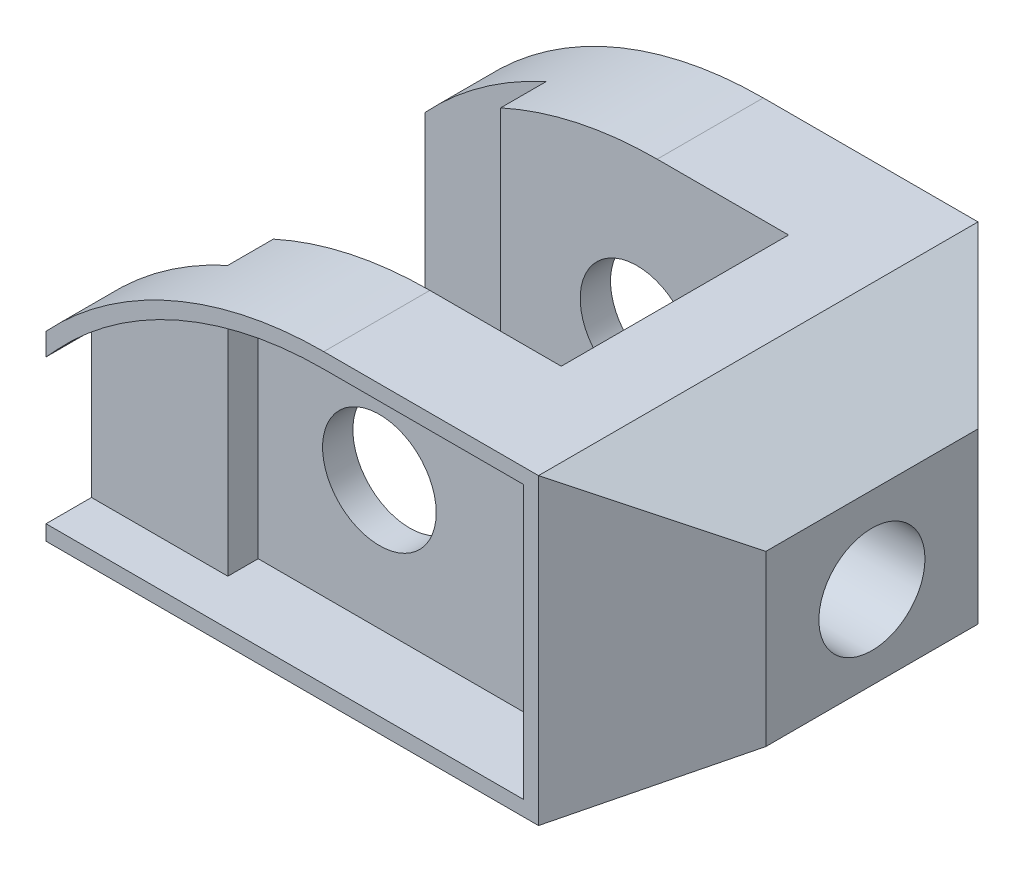
from build123d import *

# Parameters (mm, degrees)
BOSS_EXTRUDE1_DEPTH = 58
SKETCH3_R           = 7.5
CUT_EXTRUDE1_DEPTH  = 107.60206377
CUT_EXTRUDE2_DEPTH  = 107.60206377
CUT_EXTRUDE3_DEPTH  = 107.60206377
SKETCH6_R           = 7
CUT_EXTRUDE4_DEPTH  = 107.60206377
CUT_EXTRUDE5_DEPTH  = 6
CUT_EXTRUDE6_DEPTH  = 4
CUT_EXTRUDE7_START  = -6
CUT_EXTRUDE7_DEPTH  = 6
CUT_EXTRUDE8_START  = -4
CUT_EXTRUDE8_DEPTH  = 4


with BuildPart() as part:
    # Sketch2 → Boss-Extrude1 (new body)
    with BuildSketch(Plane.XY):
        with BuildLine():
            Line((0, 0), (65, 0))
            Line((65, 0), (80, 9.029262631))
            Line((80, 9.029262631), (80, 31.339745962))
            Line((80, 31.339745962), (65, 40))
            Line((65, 40), (36.66060556, 40))
            ThreePointArc((36.66060556, 40), (16.66060556, 35.82575695), (0, 24))
            Line((0, 24), (0, 0))
        make_face()
    extrude(amount=-BOSS_EXTRUDE1_DEPTH)

    # Sketch3 → Cut-Extrude1 (cut, through all)
    with BuildSketch(Plane.XY):
        with Locations((34, 19)):
            Circle(SKETCH3_R)
    extrude(amount=-CUT_EXTRUDE1_DEPTH, mode=Mode.SUBTRACT)

    # Sketch4 → Cut-Extrude2 (cut, through all)
    with BuildSketch(Plane(origin=(0, 0, 0), x_dir=(1, 0, 0), z_dir=(0, 1, 0))):
        Polygon((65, 58), (80, 43), (80, 58), align=None)
        Polygon((80, 0), (80, 15), (65, 0), align=None)
    extrude(amount=CUT_EXTRUDE2_DEPTH, mode=Mode.SUBTRACT)

    # Sketch5 → Cut-Extrude3 (cut, through all)
    with BuildSketch(Plane.XZ):
        Polygon((0, -8), (0, -50), (16, -50), (16, -44), (54, -44), (54, -14), (16, -14), (16, -8), align=None)
    extrude(amount=-CUT_EXTRUDE3_DEPTH, mode=Mode.SUBTRACT)

    # Sketch6 → Cut-Extrude4 (cut, through all)
    with BuildSketch(Plane(origin=(80, 0, 0), x_dir=(0, 0, -1), z_dir=(1, 0, 0))):
        with Locations((29, 20)):
            Circle(SKETCH6_R)
    extrude(amount=-CUT_EXTRUDE4_DEPTH, mode=Mode.SUBTRACT)

    # Sketch8 → Cut-Extrude5 (cut)
    with BuildSketch(Plane.XY):
        with BuildLine():
            Line((1.466424222, 22.64), (0, 21.058823529))
            Line((0, 21.058823529), (0, 2))
            Line((0, 2), (63, 2))
            Line((63, 2), (63, 38))
            Line((63, 38), (36.66060556, 38))
            ThreePointArc((36.66060556, 38), (17.46060556, 33.992726672), (1.466424222, 22.64))
        make_face()
    extrude(amount=-CUT_EXTRUDE5_DEPTH, mode=Mode.SUBTRACT)

    # Sketch9 → Cut-Extrude6 (cut)
    with BuildSketch(Plane.XY.offset(-6)):
        with BuildLine():
            Line((18, 2), (63, 2))
            Line((63, 2), (63, 38))
            Line((63, 38), (36.66060556, 38))
            ThreePointArc((36.66060556, 38), (27.141221384, 37.046586751), (18, 34.224221872))
            Line((18, 34.224221872), (18, 2))
        make_face()
    extrude(amount=-CUT_EXTRUDE6_DEPTH, mode=Mode.SUBTRACT)

    # Sketch10 → Cut-Extrude7 (cut)
    with BuildSketch(Plane(origin=(0, 0, -58), x_dir=(-1, 0, 0), z_dir=(0, 0, -1)).offset(CUT_EXTRUDE7_START)):
        with BuildLine():
            Line((-1.466424222, 22.64), (0, 21.058823529))
            Line((0, 21.058823529), (0, 2))
            Line((0, 2), (-63, 2))
            Line((-63, 2), (-63, 38))
            Line((-63, 38), (-36.66060556, 38))
            ThreePointArc((-36.66060556, 38), (-17.46060556, 33.992726672), (-1.466424222, 22.64))
        make_face()
    extrude(amount=CUT_EXTRUDE7_DEPTH, mode=Mode.SUBTRACT)

    # Sketch11 → Cut-Extrude8 (cut)
    with BuildSketch(Plane(origin=(0, 0, -52), x_dir=(-1, 0, 0), z_dir=(0, 0, -1)).offset(CUT_EXTRUDE8_START)):
        with BuildLine():
            Line((-63, 38), (-63, 2))
            Line((-63, 2), (-18, 2))
            Line((-18, 2), (-18, 34.224221872))
            ThreePointArc((-18, 34.224221872), (-27.141221384, 37.046586751), (-36.66060556, 38))
            Line((-36.66060556, 38), (-63, 38))
        make_face()
    extrude(amount=CUT_EXTRUDE8_DEPTH, mode=Mode.SUBTRACT)


solid = part.part
